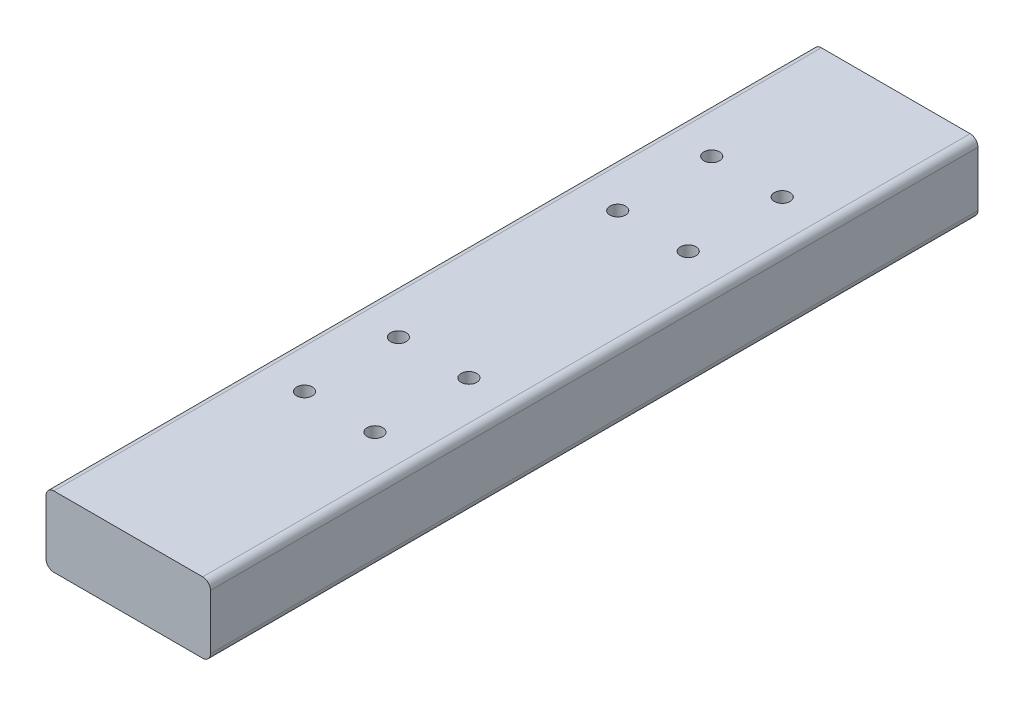
from build123d import *

# Parameters (mm, degrees)
SKETCH1_W           = 42
SKETCH1_H           = 18
BOSS_EXTRUDE1_DEPTH = 196
FILLET1_R           = 2
SKETCH2_R           = 2
CUT_EXTRUDE1_DEPTH  = 202.25605581


with BuildPart() as part:
    # Sketch1 → Boss-Extrude1 (new body)
    with BuildSketch(Plane.XY):
        with Locations((21, 9)):
            Rectangle(SKETCH1_W, SKETCH1_H)
    extrude(amount=BOSS_EXTRUDE1_DEPTH)

    # Fillet1
    fillet1_edges = [part.edges().sort_by_distance(p)[0] for p in [
        (0, 18, 98),
        (42, 18, 98),
        (42, 0, 98),
        (0, 0, 98),
    ]]
    fillet(fillet1_edges, radius=FILLET1_R)

    # Sketch2 → Cut-Extrude1 (cut, through all)
    with BuildSketch(Plane.XZ):
        with Locations(Location((12, 142, 0), (0, 0, 270))):
            Circle(SKETCH2_R)
        with Locations(Location((30, 142, 0), (0, 0, 270))):
            Circle(SKETCH2_R)
        with Locations(Location((12, 118, 0), (0, 0, 270))):
            Circle(SKETCH2_R)
        with Locations(Location((30, 118, 0), (0, 0, 270))):
            Circle(SKETCH2_R)
        with Locations(Location((12, 62, 0), (0, 0, 270))):
            Circle(SKETCH2_R)
        with Locations(Location((30, 62, 0), (0, 0, 270))):
            Circle(SKETCH2_R)
        with Locations(Location((30, 38, 0), (0, 0, 270))):
            Circle(SKETCH2_R)
        with Locations(Location((12, 38, 0), (0, 0, 270))):
            Circle(SKETCH2_R)
    extrude(amount=-CUT_EXTRUDE1_DEPTH, mode=Mode.SUBTRACT)


solid = part.part
